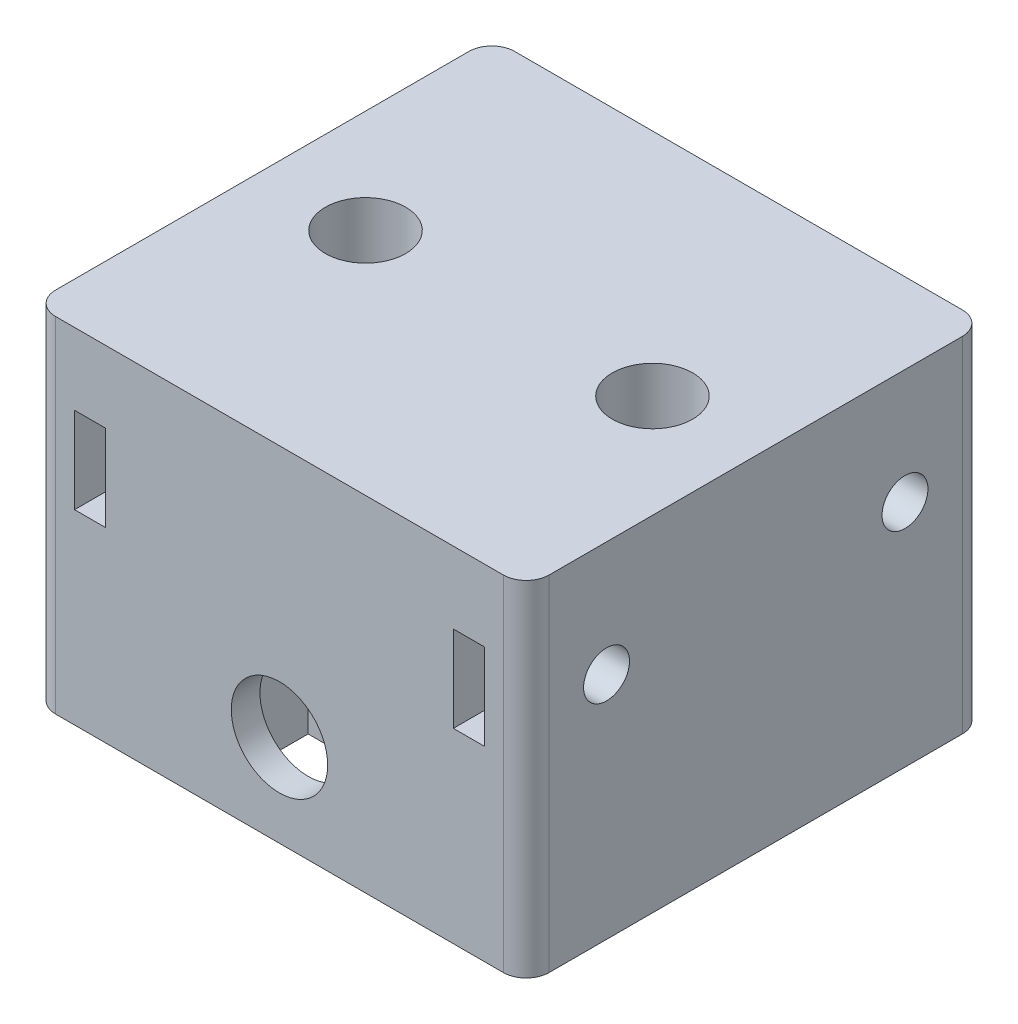
from build123d import *

# Parameters (mm, degrees)
SKETCH1_W            = 45
SKETCH1_H            = 40
BOSS_EXTRUDE1_DEPTH  = 30
CUT_EXTRUDE1_DEPTH   = 25
SKETCH3_R            = 2
CUT_EXTRUDE2_DEPTH   = 959.969914124
SKETCH7_R            = 2
CUT_EXTRUDE4_DEPTH   = 470.526936912
SKETCH9_W            = 2.7
SKETCH9_H            = 7.5
CUT_EXTRUDE5_DEPTH   = 10.75
CUT_EXTRUDE6_START   = -40
SKETCH9_2_W          = 2.7
SKETCH9_2_H          = 7.5
CUT_EXTRUDE6_DEPTH   = 10.75
SKETCH10_R           = 3.5
CUT_EXTRUDE9_DEPTH   = 1066.96024555
SKETCH13_R           = 4.2
CUT_EXTRUDE10_DEPTH  = 959.969914124
SKETCH14_OUTSIDE_W   = 60.454
SKETCH14_OUTSIDE_H   = 45.454
SKETCH14_OUTSIDE_W_2 = 43
SKETCH14_OUTSIDE_H_2 = 30
CUT_EXTRUDE11_DEPTH  = 959.969914124
FILLET1_R            = 2
SKETCH15_W           = 14
SKETCH15_H           = 7
CUT_EXTRUDE12_DEPTH  = 10
CUT_EXTRUDE13_DEPTH  = 7


with BuildPart() as part:
    # Sketch1 → Boss-Extrude1 (new body)
    with BuildSketch(Plane.XZ.offset(-23.265807416)):
        with Locations((-935.352806229, 446.786082367)):
            Rectangle(SKETCH1_W, SKETCH1_H)
    extrude(amount=BOSS_EXTRUDE1_DEPTH)

    # Sketch2 → Cut-Extrude1 (cut)
    with BuildSketch(Plane.XZ.offset(6.734192584)):
        Polygon((-922.852806229, 453.136935328), (-928.352806229, 449.961508847), (-928.352806229, 443.610655886), (-922.852806229, 440.435229406), (-917.352806229, 443.610655886), (-917.352806229, 449.961508847), align=None)
        Polygon((-947.852806229, 453.136935328), (-953.352806229, 449.961508847), (-953.352806229, 443.610655886), (-947.852806229, 440.435229406), (-942.352806229, 443.610655886), (-942.352806229, 449.961508847), align=None)
    extrude(amount=-CUT_EXTRUDE1_DEPTH, mode=Mode.SUBTRACT)

    # Sketch3 → Cut-Extrude2 (cut, through all)
    with BuildSketch(Plane(origin=(0, 0, 426.786082367), x_dir=(-1, 0, 0), z_dir=(0, 0, -1))):
        with Locations((935.352806229, 1.265807416)):
            Circle(SKETCH3_R)
    extrude(amount=-CUT_EXTRUDE2_DEPTH, mode=Mode.SUBTRACT)

    # Sketch7 → Cut-Extrude4 (cut, through all)
    with BuildSketch(Plane.ZY.offset(957.852806229)):
        with Locations((433.786082367, 13.265807416)):
            Circle(SKETCH7_R)
        with Locations((459.786082367, 13.265807416)):
            Circle(SKETCH7_R)
    extrude(amount=-CUT_EXTRUDE4_DEPTH, mode=Mode.SUBTRACT)

    # Sketch9 → Cut-Extrude5 (cut)
    with BuildSketch(Plane(origin=(0, 0, 426.786082367), x_dir=(-1, 0, 0), z_dir=(0, 0, -1))):
        with Locations((918.852806229, 13.265807416)):
            Rectangle(SKETCH9_W, SKETCH9_H)
        with Locations((951.852806229, 13.265807416)):
            Rectangle(SKETCH9_W, SKETCH9_H)
    extrude(amount=-CUT_EXTRUDE5_DEPTH, mode=Mode.SUBTRACT)

    # Sketch9<2> → Cut-Extrude6 (cut)
    with BuildSketch(Plane(origin=(0, 0, 426.786082367), x_dir=(-1, 0, 0), z_dir=(0, 0, -1)).offset(CUT_EXTRUDE6_START)):
        with Locations((918.852806229, 13.265807416)):
            Rectangle(SKETCH9_2_W, SKETCH9_2_H)
        with Locations((951.852806229, 13.265807416)):
            Rectangle(SKETCH9_2_W, SKETCH9_2_H)
    extrude(amount=CUT_EXTRUDE6_DEPTH, mode=Mode.SUBTRACT)

    # Sketch10 → Cut-Extrude9 (cut, through all)
    with BuildSketch(Plane.XZ.offset(6.734192584)):
        with Locations(Location((-947.852806229, 446.786082367, 0), (0, 0, 270))):
            Circle(SKETCH10_R)
        with Locations(Location((-922.852806229, 446.786082367, 0), (0, 0, 270))):
            Circle(SKETCH10_R)
    extrude(amount=-CUT_EXTRUDE9_DEPTH, mode=Mode.SUBTRACT)

    # Sketch13 → Cut-Extrude10 (cut, through all)
    with BuildSketch(Plane.XY.offset(466.786082367)):
        with Locations((-935.352806229, 1.265807416)):
            Circle(SKETCH13_R)
    extrude(amount=-CUT_EXTRUDE10_DEPTH, mode=Mode.SUBTRACT)

    # Sketch14 outside → Cut-Extrude11 (cut, through all)
    with BuildSketch(Plane(origin=(0, 0, 426.786082367), x_dir=(-1, 0, 0), z_dir=(0, 0, -1))):
        with Locations((935.353, 8.266)):
            Rectangle(SKETCH14_OUTSIDE_W, SKETCH14_OUTSIDE_H)
        with Locations((935.352806229, 8.265807416)):
            Rectangle(SKETCH14_OUTSIDE_W_2, SKETCH14_OUTSIDE_H_2, mode=Mode.SUBTRACT)
    extrude(amount=-CUT_EXTRUDE11_DEPTH, mode=Mode.SUBTRACT)

    # Fillet1
    fillet1_edges = [part.edges().sort_by_distance(p)[0] for p in [
        (-956.852806229, 8.265807416, 466.786082367),
        (-956.852806229, 8.265807416, 426.786082367),
        (-913.852806229, 8.265807416, 426.786082367),
        (-913.852806229, 8.265807416, 466.786082367),
    ]]
    fillet(fillet1_edges, radius=FILLET1_R)

    # Sketch15 → Cut-Extrude12 (cut)
    with BuildSketch(Plane.XZ.offset(6.734192584)):
        with Locations((-935.352806229, 460.786082367)):
            Rectangle(SKETCH15_W, SKETCH15_H)
    extrude(amount=-CUT_EXTRUDE12_DEPTH, mode=Mode.SUBTRACT)

    # Sketch16 → Cut-Extrude13 (cut)
    with BuildSketch(Plane.XY.offset(457.286082367)):
        Polygon((-928.352806229, 5.3072593), (-935.352806229, 9.348711184), (-942.352806229, 5.3072593), (-942.352806229, -2.775644469), (-935.352806229, -6.817096353), (-928.352806229, -2.775644469), align=None)
    extrude(amount=CUT_EXTRUDE13_DEPTH, mode=Mode.SUBTRACT)


solid = part.part
